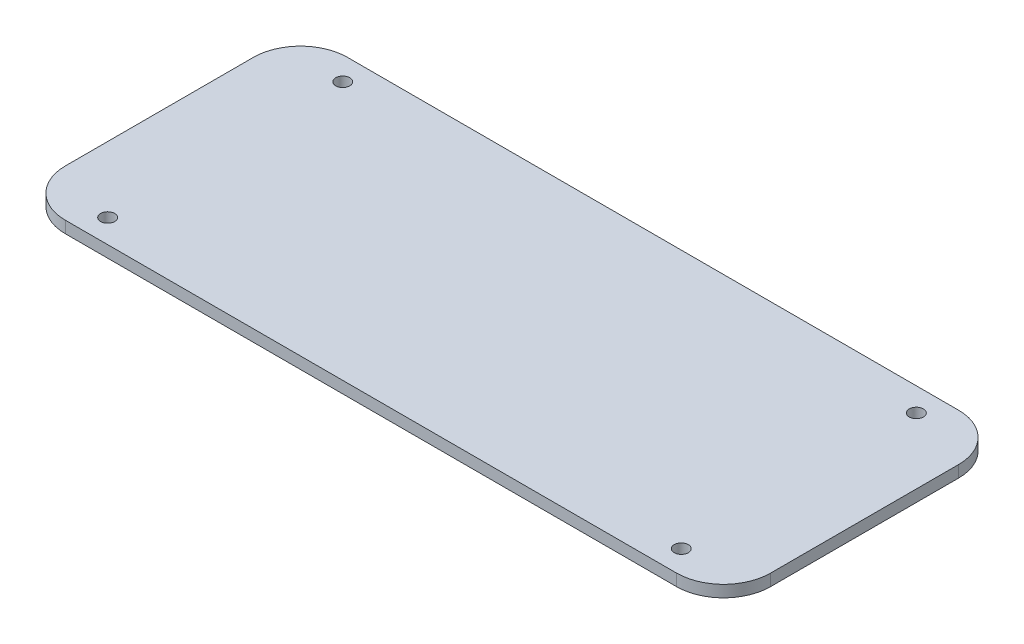
from build123d import *

# Parameters (mm, degrees)
BOSS_EXTRUDE1_DEPTH = 2.5
SKETCH2_R           = 1.5
CUT_EXTRUDE1_DEPTH  = 162.574286321


with BuildPart() as part:
    # Sketch1 → Boss-Extrude1 (new body)
    with BuildSketch(Plane(origin=(0, 0, 0), x_dir=(1, 0, 0), z_dir=(0, 1, 0))):
        with BuildLine():
            Line((10, 0), (140, 0))
            ThreePointArc((140, 0), (147.071067812, 2.928932188), (150, 10))
            Line((150, 10), (150, 50))
            ThreePointArc((150, 50), (147.071067812, 57.071067812), (140, 60))
            Line((140, 60), (10, 60))
            ThreePointArc((10, 60), (2.928932188, 57.071067812), (0, 50))
            Line((0, 50), (0, 10))
            ThreePointArc((0, 10), (2.928932188, 2.928932188), (10, 0))
        make_face()
    extrude(amount=BOSS_EXTRUDE1_DEPTH)

    # Sketch2 → Cut-Extrude1 (cut, through all)
    with BuildSketch(Plane(origin=(0, 2.5, 0), x_dir=(1, 0, 0), z_dir=(0, 1, 0))):
        with Locations(Location((14, 5, 0), (0, 0, 270))):
            Circle(SKETCH2_R)
        with Locations(Location((14, 55, 0), (0, 0, 270))):
            Circle(SKETCH2_R)
        with Locations(Location((136, 5, 0), (0, 0, 90))):
            Circle(SKETCH2_R)
        with Locations(Location((136, 55, 0), (0, 0, 90))):
            Circle(SKETCH2_R)
    extrude(amount=-CUT_EXTRUDE1_DEPTH, mode=Mode.SUBTRACT)


solid = part.part
